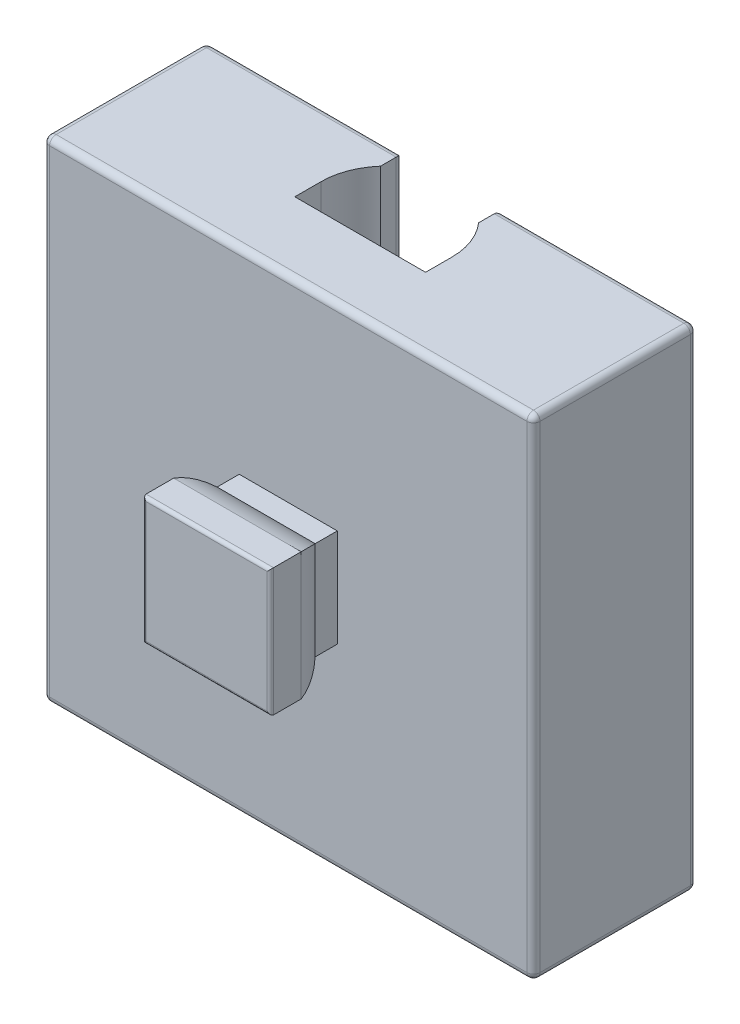
from build123d import *

# Parameters (mm, degrees)
SKETCH_1_W                      = 15
SKETCH_1_H                      = 15
EXTRUDE_1_DEPTH                 = 5
SKETCH_2_W                      = 3
SKETCH_2_H                      = 3
EXTRUDE_2_DEPTH                 = 1
EXTRUDE_3_DEPTH                 = 2
EXTRUDE_3_DEPTH_BACK            = 2
CUT_EXTRUDE_1_REACH             = 13.726
CUT_EXTRUDE_1_DIRECTION_2_REACH = 13.726
CUT_EXTRUDE_2_REACH             = 19.5
FILLET_1_R                      = 0.1
FILLET_2_R                      = 0.2


with BuildPart() as part:
    # 草图1 → 凸台-拉伸1 (new body)
    with BuildSketch(Plane.XY):
        Rectangle(SKETCH_1_W, SKETCH_1_H)
    extrude(amount=-EXTRUDE_1_DEPTH)

    # 草图2 → 凸台-拉伸2 (add)
    with BuildSketch(Plane.XY):
        Rectangle(SKETCH_2_W, SKETCH_2_H)
    extrude(amount=EXTRUDE_2_DEPTH)

    # 草图3 → 凸台-拉伸3 (add, two sides: drawn at the far end of the back side and taken through both)
    with BuildSketch(Plane(origin=(0, 0, 0), x_dir=(1, 0, 0), z_dir=(0, 1, 0)).offset(-EXTRUDE_3_DEPTH_BACK)):
        with BuildLine():
            Line((-1.95, -2.5), (1.95, -2.5))
            Line((1.95, -2.5), (1.95, -1.555590279))
            ThreePointArc((1.95, -1.555590279), (1.780042303, -1.088161527), (1.5, -0.677124344))
            Line((1.5, -0.677124344), (-1.5, -0.677124344))
            ThreePointArc((-1.5, -0.677124344), (-1.780042303, -1.088161527), (-1.95, -1.555590279))
            Line((-1.95, -1.555590279), (-1.95, -2.5))
        make_face()
    extrude(amount=EXTRUDE_3_DEPTH + EXTRUDE_3_DEPTH_BACK)

    # 草图4 → 切除-拉伸1 (cut, up to next)
    with BuildSketch(Plane(origin=(0, 0, 0), x_dir=(0, 0, -1), z_dir=(1, 0, 0)), mode=Mode.PRIVATE) as cut_extrude_1_sk1:
        with BuildLine():
            Line((-2.5, 1.95), (-1.555590279, 1.95))
            ThreePointArc((-1.555590279, 1.95), (-1.088161527, 1.780042303), (-0.677124344, 1.5))
            Line((-0.677124344, 1.5), (-0.677124344, 2))
            Line((-0.677124344, 2), (-2.5, 2))
            Line((-2.5, 2), (-2.5, 1.95))
        make_face()
    cut_extrude_1_tool1 = extrude(cut_extrude_1_sk1.sketch, amount=-CUT_EXTRUDE_1_REACH, mode=Mode.PRIVATE) & part.part
    # 草图4 → 切除-拉伸1 (cut, up to next)
    with BuildSketch(Plane(origin=(0, 0, 0), x_dir=(0, 0, -1), z_dir=(1, 0, 0)), mode=Mode.PRIVATE) as cut_extrude_1_sk2:
        with BuildLine():
            Line((-2.5, -2), (-0.677124344, -2))
            Line((-0.677124344, -2), (-0.677124344, -1.5))
            ThreePointArc((-0.677124344, -1.5), (-1.088161527, -1.780042303), (-1.555590279, -1.95))
            Line((-1.555590279, -1.95), (-2.5, -1.95))
            Line((-2.5, -1.95), (-2.5, -2))
        make_face()
    cut_extrude_1_tool2 = extrude(cut_extrude_1_sk2.sketch, amount=-CUT_EXTRUDE_1_REACH, mode=Mode.PRIVATE) & part.part
    add(cut_extrude_1_tool1.solids().sort_by_distance((0, 1.873038, 1.175075))[0], mode=Mode.SUBTRACT)
    add(cut_extrude_1_tool2.solids().sort_by_distance((0, -1.873038, 1.175075))[0], mode=Mode.SUBTRACT)

    # 草图4 → 切除-拉伸1 direction 2 (cut, up to next)
    with BuildSketch(Plane(origin=(0, 0, 0), x_dir=(0, 0, -1), z_dir=(1, 0, 0)), mode=Mode.PRIVATE) as cut_extrude_1_direction_2_sk1:
        with BuildLine():
            Line((-2.5, 1.95), (-1.555590279, 1.95))
            ThreePointArc((-1.555590279, 1.95), (-1.088161527, 1.780042303), (-0.677124344, 1.5))
            Line((-0.677124344, 1.5), (-0.677124344, 2))
            Line((-0.677124344, 2), (-2.5, 2))
            Line((-2.5, 2), (-2.5, 1.95))
        make_face()
    cut_extrude_1_direction_2_tool1 = extrude(cut_extrude_1_direction_2_sk1.sketch, amount=CUT_EXTRUDE_1_DIRECTION_2_REACH, mode=Mode.PRIVATE) & part.part
    # 草图4 → 切除-拉伸1 direction 2 (cut, up to next)
    with BuildSketch(Plane(origin=(0, 0, 0), x_dir=(0, 0, -1), z_dir=(1, 0, 0)), mode=Mode.PRIVATE) as cut_extrude_1_direction_2_sk2:
        with BuildLine():
            Line((-2.5, -2), (-0.677124344, -2))
            Line((-0.677124344, -2), (-0.677124344, -1.5))
            ThreePointArc((-0.677124344, -1.5), (-1.088161527, -1.780042303), (-1.555590279, -1.95))
            Line((-1.555590279, -1.95), (-2.5, -1.95))
            Line((-2.5, -1.95), (-2.5, -2))
        make_face()
    cut_extrude_1_direction_2_tool2 = extrude(cut_extrude_1_direction_2_sk2.sketch, amount=CUT_EXTRUDE_1_DIRECTION_2_REACH, mode=Mode.PRIVATE) & part.part
    add(cut_extrude_1_direction_2_tool1.solids().sort_by_distance((0, 1.873038, 1.175075))[0], mode=Mode.SUBTRACT)
    add(cut_extrude_1_direction_2_tool2.solids().sort_by_distance((0, -1.873038, 1.175075))[0], mode=Mode.SUBTRACT)

    # 草图5 → 切除-拉伸2 (cut, up to next)
    with BuildSketch(Plane.XZ.offset(7.5), mode=Mode.PRIVATE) as cut_extrude_2_sk1:
        with BuildLine():
            Line((-1.5, -5), (-1.5, -4.322875656))
            ThreePointArc((-1.5, -4.322875656), (-1.870828693, -3.707106781), (-2, -3))
            Line((-2, -3), (-2, -2.2))
            Line((-2, -2.2), (2, -2.2))
            Line((2, -2.2), (2, -3))
            ThreePointArc((2, -3), (1.870828693, -3.707106781), (1.5, -4.322875656))
            Line((1.5, -4.322875656), (1.5, -5))
            Line((1.5, -5), (-1.5, -5))
        make_face()
    cut_extrude_2_tool1 = extrude(cut_extrude_2_sk1.sketch, amount=-CUT_EXTRUDE_2_REACH, mode=Mode.PRIVATE) & part.part
    add(cut_extrude_2_tool1.solids().sort_by_distance((0, -7.5, -3.51237))[0], mode=Mode.SUBTRACT)

    # 圆角1
    fillet_1_edges = [part.edges().sort_by_distance(p)[0] for p in [
        (-1.95, 0, 2.5),
        (1.95, 0, 2.5),
        (0, -1.95, 2.5),
        (0, 1.95, 2.5),
    ]]
    fillet(fillet_1_edges, radius=FILLET_1_R)

    # 圆角2
    fillet_2_edges = [part.edges().sort_by_distance(p)[0] for p in [
        (7.5, 0, -5),
        (4.5, 7.5, -5),
        (-7.5, 0, -5),
        (0, 7.5, 0),
        (7.5, 0, 0),
        (0, -7.5, 0),
        (-7.5, 0, 0),
        (-4.5, -7.5, -5),
        (-7.5, 7.5, -2.5),
        (7.5, 7.5, -2.5),
        (7.5, -7.5, -2.5),
        (-7.5, -7.5, -2.5),
        (-4.5, 7.5, -5),
        (4.5, -7.5, -5),
        (1.5, 0, -5),
        (-1.5, 0, -5),
    ]]
    fillet(fillet_2_edges, radius=FILLET_2_R)


solid = part.part
